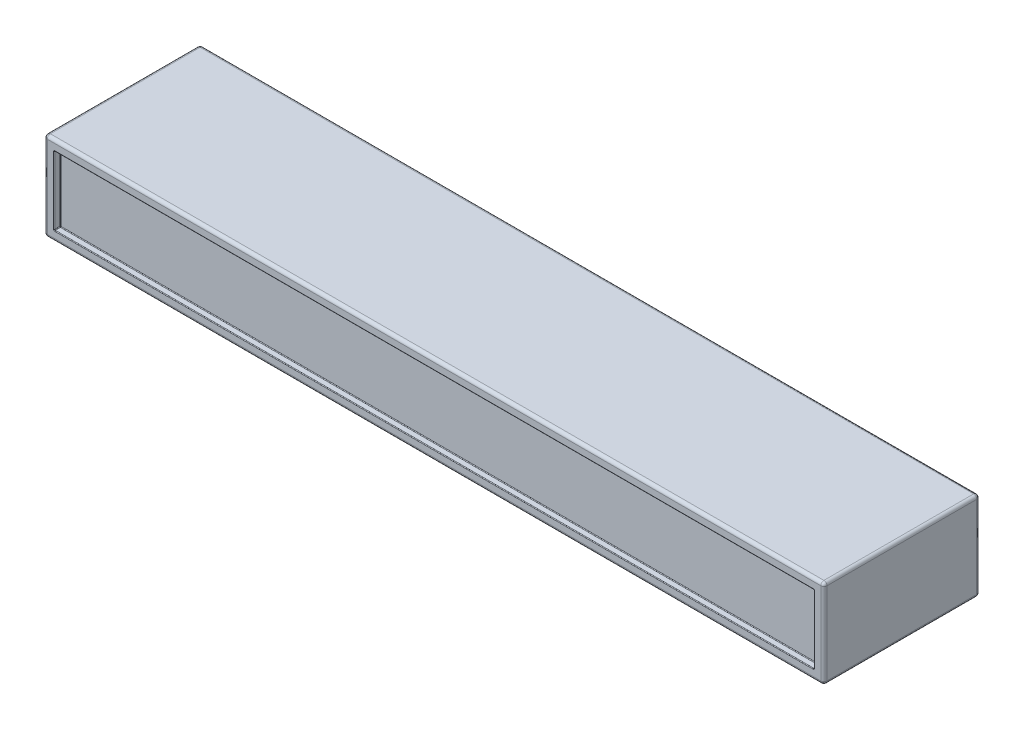
from build123d import *

# Parameters (mm, degrees)
SKETCH1_W           = 2500
SKETCH1_H           = 284
BOSS_EXTRUDE1_DEPTH = 500
FILLET1_R           = 10
SKETCH2_W           = 2436
SKETCH2_H           = 220
CUT_EXTRUDE1_DEPTH  = 20
FILLET2_R           = 2


with BuildPart() as part:
    # Sketch1 → Boss-Extrude1 (new body)
    with BuildSketch(Plane.XY):
        with Locations((1250, 142)):
            Rectangle(SKETCH1_W, SKETCH1_H)
    extrude(amount=BOSS_EXTRUDE1_DEPTH)

    # Fillet1
    fillet1_edges = [part.edges().sort_by_distance(p)[0] for p in [
        (2500, 142, 500),
        (1250, 284, 500),
        (0, 142, 500),
        (1250, 284, 0),
        (2500, 142, 0),
        (1250, 0, 0),
        (0, 142, 0),
        (0, 284, 250),
        (2500, 284, 250),
        (2500, 0, 250),
        (0, 0, 250),
        (1250, 0, 500),
    ]]
    fillet(fillet1_edges, radius=FILLET1_R)

    # Sketch2 → Cut-Extrude1 (cut)
    with BuildSketch(Plane.XY.offset(500)):
        with Locations((1250, 142)):
            Rectangle(SKETCH2_W, SKETCH2_H)
    extrude(amount=-CUT_EXTRUDE1_DEPTH, mode=Mode.SUBTRACT)

    # Fillet2
    fillet2_edges = [part.edges().sort_by_distance(p)[0] for p in [
        (2468, 142, 480),
        (2468, 252, 490),
        (1250, 32, 480),
        (2468, 32, 490),
        (32, 142, 480),
        (32, 32, 490),
        (1250, 252, 480),
        (32, 252, 490),
        (2468, 142, 500),
        (1250, 252, 500),
        (32, 142, 500),
        (1250, 32, 500),
    ]]
    fillet(fillet2_edges, radius=FILLET2_R)


solid = part.part
